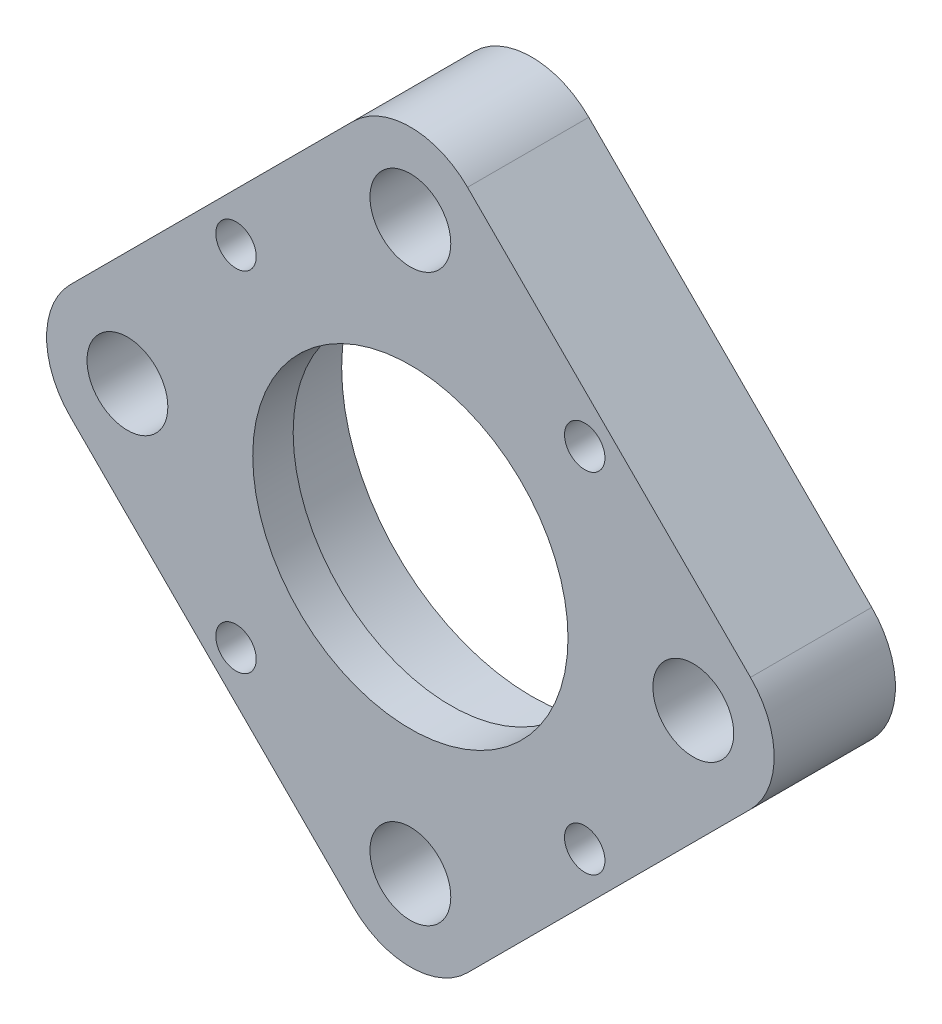
from build123d import *

# Parameters (mm, degrees)
SZKIC1_R                    = 35
SZKIC1_R_2                  = 23.5
SZKIC1_R_3                  = 19.5
DODANIE_WYCI_GNI_CIE3_DEPTH = 5
DODANIE_WYCI_GNI_CIE5_START = 10
SZKIC4_R                    = 35
SZKIC4_R_2                  = 23.5
DODANIE_WYCI_GNI_CIE5_DEPTH = 10
SZKIC13_R                   = 10
DODANIE_WYCI_GNI_CIE6_DEPTH = 15
OTWORY_USTALAJ_CE_10_0MM1_D = 10
OTWORY_USTALAJ_CE_5_0MM3_D  = 5
DODANIE_WYCI_GNI_CIE7_DEPTH = 15
SZKIC28_R                   = 52.509364788
WYTNIJ_WYCI_GNI_CIE6_DEPTH  = 15


with BuildPart() as part:
    # Szkic1 → Dodanie-wyciągnięcie3 (new body)
    # profile 1 of 2: a face of its own
    with BuildSketch(Plane.XY):
        Circle(SZKIC1_R)
        Circle(SZKIC1_R_2, mode=Mode.SUBTRACT)
    # profile 2 of 2: a face of its own
    with BuildSketch(Plane.XY):
        Circle(SZKIC1_R_2)
        Circle(SZKIC1_R_3, mode=Mode.SUBTRACT)
    extrude(amount=DODANIE_WYCI_GNI_CIE3_DEPTH)

    # Szkic4 → Dodanie-wyciągnięcie5 (add)
    with BuildSketch(Plane(origin=(0, 0, 0), x_dir=(-1, 0, 0), z_dir=(0, 0, -1)).offset(DODANIE_WYCI_GNI_CIE5_START)):
        Circle(SZKIC4_R)
        Circle(SZKIC4_R_2, mode=Mode.SUBTRACT)
    extrude(amount=-DODANIE_WYCI_GNI_CIE5_DEPTH)

    # Szkic13 → Dodanie-wyciągnięcie6 (add)
    with BuildSketch(Plane(origin=(0, 0, -10), x_dir=(-1, 0, 0), z_dir=(0, 0, -1))):
        with Locations((0, 35)):
            Circle(SZKIC13_R)
        with Locations((0, -35)):
            Circle(SZKIC13_R)
        with Locations((-35, 0)):
            Circle(SZKIC13_R)
        with Locations((35, 0)):
            Circle(SZKIC13_R)
    extrude(amount=-DODANIE_WYCI_GNI_CIE6_DEPTH)

    # Otwory ustalające Ø10.0mm1 (through all)
    with Locations(Plane.XY.offset(5)):
        with Locations((0, 35), (0, -35), (-35, 0), (35, 0)):
            Hole(OTWORY_USTALAJ_CE_10_0MM1_D / 2)

    # Otwory ustalające Ø5.0mm3 (through all)
    with Locations(Plane.XY.offset(5)):
        with Locations((-21.566756826, 21.566756826), (21.566756826, 21.566756826), (21.566756826, -21.566756826), (-21.566756826, -21.566756826)):
            Hole(OTWORY_USTALAJ_CE_5_0MM3_D / 2)

    # Szkic27 → Dodanie-wyciągnięcie7 (add)
    with BuildSketch(Plane(origin=(0, 0, -10), x_dir=(-1, 0, 0), z_dir=(0, 0, -1))):
        with BuildLine():
            ThreePointArc((33.571428571, 9.897433186), (38.155396436, 9.48912395), (42.071067812, 7.071067812))
            Line((42.071067812, 7.071067812), (27.531241216, 21.610894407))
            ThreePointArc((27.531241216, 21.610894407), (31.107641461, 16.041029978), (33.571428571, 9.897433186))
        make_face()
        with BuildLine():
            ThreePointArc((9.897433186, 33.571428571), (16.041029978, 31.107641461), (21.610894407, 27.531241216))
            Line((21.610894407, 27.531241216), (7.071067812, 42.071067812))
            ThreePointArc((7.071067812, 42.071067812), (9.48912395, 38.155396436), (9.897433186, 33.571428571))
        make_face()
        with BuildLine():
            ThreePointArc((-9.897433186, 33.571428571), (-9.48912395, 38.155396436), (-7.071067812, 42.071067812))
            Line((-7.071067812, 42.071067812), (-21.610894407, 27.531241216))
            ThreePointArc((-21.610894407, 27.531241216), (-16.041029978, 31.107641461), (-9.897433186, 33.571428571))
        make_face()
        with BuildLine():
            ThreePointArc((-33.571428571, 9.897433186), (-31.107641461, 16.041029978), (-27.531241216, 21.610894407))
            Line((-27.531241216, 21.610894407), (-42.071067812, 7.071067812))
            ThreePointArc((-42.071067812, 7.071067812), (-38.155396436, 9.48912395), (-33.571428571, 9.897433186))
        make_face()
        with BuildLine():
            Line((-42.071067812, -7.071067812), (-27.531241216, -21.610894407))
            ThreePointArc((-27.531241216, -21.610894407), (-31.107641461, -16.041029978), (-33.571428571, -9.897433186))
            ThreePointArc((-33.571428571, -9.897433186), (-38.155396436, -9.48912395), (-42.071067812, -7.071067812))
        make_face()
        with BuildLine():
            Line((-21.610894407, -27.531241216), (-7.071067812, -42.071067812))
            ThreePointArc((-7.071067812, -42.071067812), (-9.48912395, -38.155396436), (-9.897433186, -33.571428571))
            ThreePointArc((-9.897433186, -33.571428571), (-16.041029978, -31.107641461), (-21.610894407, -27.531241216))
        make_face()
        with BuildLine():
            Line((7.071067812, -42.071067812), (21.610894407, -27.531241216))
            ThreePointArc((21.610894407, -27.531241216), (16.041029978, -31.107641461), (9.897433186, -33.571428571))
            ThreePointArc((9.897433186, -33.571428571), (9.48912395, -38.155396436), (7.071067812, -42.071067812))
        make_face()
        with BuildLine():
            Line((27.531241216, -21.610894407), (42.071067812, -7.071067812))
            ThreePointArc((42.071067812, -7.071067812), (38.155396436, -9.48912395), (33.571428571, -9.897433186))
            ThreePointArc((33.571428571, -9.897433186), (31.107641461, -16.041029978), (27.531241216, -21.610894407))
        make_face()
    extrude(amount=-DODANIE_WYCI_GNI_CIE7_DEPTH)

    # Szkic28 → Wytnij-wyciągnięcie6 (cut)
    # profile 1 of 5: a face of its own
    with BuildSketch(Plane(origin=(0, 0, -10), x_dir=(-1, 0, 0), z_dir=(0, 0, -1))):
        Circle(SZKIC28_R)
        with BuildLine():
            Line((49.142135624, 0), (42.071067812, -7.071067812))
            Line((42.071067812, -7.071067812), (41.070360041, -8.071775583))
            Line((41.070360041, -8.071775583), (27.531241216, -21.610894407))
            ThreePointArc((27.531241216, -21.610894407), (24.748737342, -24.748737342), (21.610894407, -27.531241216))
            Line((21.610894407, -27.531241216), (7.071067812, -42.071067812))
            Line((7.071067812, -42.071067812), (0, -49.142135624))
            Line((0, -49.142135624), (-7.071067812, -42.071067812))
            Line((-7.071067812, -42.071067812), (-21.610894407, -27.531241216))
            ThreePointArc((-21.610894407, -27.531241216), (-24.748737342, -24.748737342), (-27.531241216, -21.610894407))
            Line((-27.531241216, -21.610894407), (-42.071067812, -7.071067812))
            Line((-42.071067812, -7.071067812), (-49.142135624, 0))
            Line((-49.142135624, 0), (-42.071067812, 7.071067812))
            Line((-42.071067812, 7.071067812), (-27.531241216, 21.610894407))
            ThreePointArc((-27.531241216, 21.610894407), (-24.748737342, 24.748737342), (-21.610894407, 27.531241216))
            Line((-21.610894407, 27.531241216), (-7.071067812, 42.071067812))
            Line((-7.071067812, 42.071067812), (0, 49.142135624))
            Line((0, 49.142135624), (7.071067812, 42.071067812))
            Line((7.071067812, 42.071067812), (21.610894407, 27.531241216))
            ThreePointArc((21.610894407, 27.531241216), (24.748737342, 24.748737342), (27.531241216, 21.610894407))
            Line((27.531241216, 21.610894407), (42.071067812, 7.071067812))
            Line((42.071067812, 7.071067812), (49.142135624, 0))
        make_face(mode=Mode.SUBTRACT)
    # profile 2 of 5: a face of its own
    with BuildSketch(Plane(origin=(0, 0, -10), x_dir=(-1, 0, 0), z_dir=(0, 0, -1))):
        with BuildLine():
            ThreePointArc((21.610894407, -27.531241216), (24.748737342, -24.748737342), (27.531241216, -21.610894407))
            Line((27.531241216, -21.610894407), (21.610894407, -27.531241216))
        make_face()
    # profile 3 of 5: a face of its own
    with BuildSketch(Plane(origin=(0, 0, -10), x_dir=(-1, 0, 0), z_dir=(0, 0, -1))):
        with BuildLine():
            ThreePointArc((-27.531241216, -21.610894407), (-24.748737342, -24.748737342), (-21.610894407, -27.531241216))
            Line((-21.610894407, -27.531241216), (-27.531241216, -21.610894407))
        make_face()
    # profile 4 of 5: a face of its own
    with BuildSketch(Plane(origin=(0, 0, -10), x_dir=(-1, 0, 0), z_dir=(0, 0, -1))):
        with BuildLine():
            Line((-27.531241216, 21.610894407), (-21.610894407, 27.531241216))
            ThreePointArc((-21.610894407, 27.531241216), (-24.748737342, 24.748737342), (-27.531241216, 21.610894407))
        make_face()
    # profile 5 of 5: a face of its own
    with BuildSketch(Plane(origin=(0, 0, -10), x_dir=(-1, 0, 0), z_dir=(0, 0, -1))):
        with BuildLine():
            Line((21.610894407, 27.531241216), (27.531241216, 21.610894407))
            ThreePointArc((27.531241216, 21.610894407), (24.748737342, 24.748737342), (21.610894407, 27.531241216))
        make_face()
    extrude(amount=-WYTNIJ_WYCI_GNI_CIE6_DEPTH, mode=Mode.SUBTRACT)


solid = part.part
